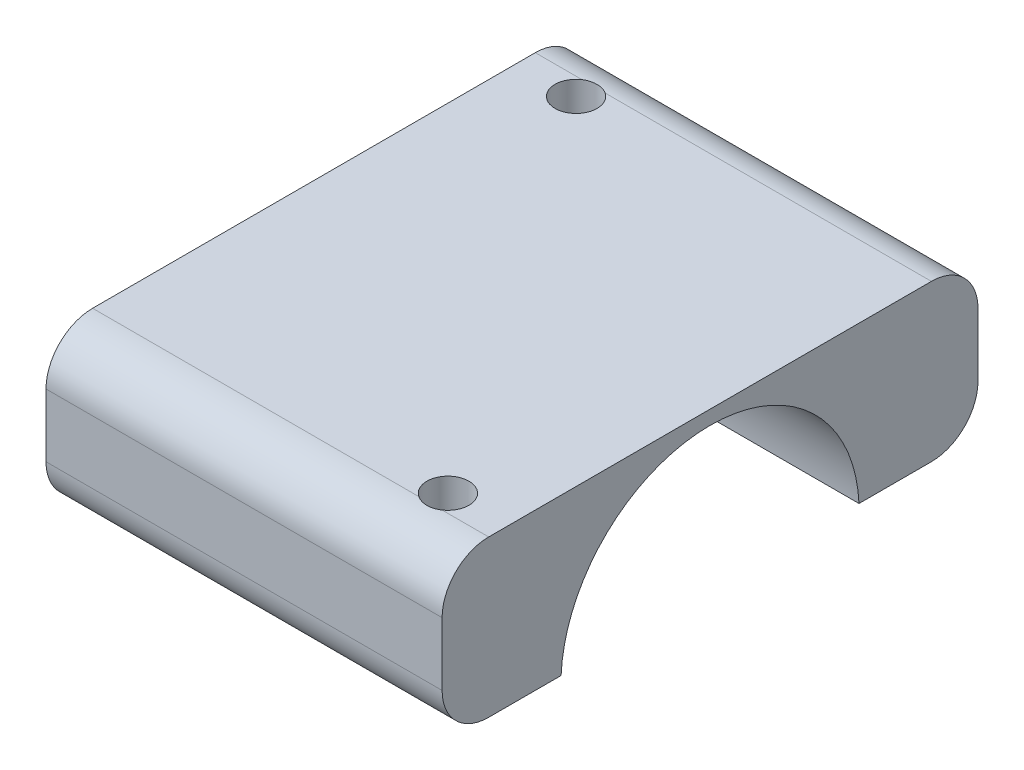
from build123d import *

# Parameters (mm, degrees)
BOSS_EXTRUDE1_DEPTH     = 17
CUT_EXTRUDE1_DEPTH      = 32.84732455
CUT_EXTRUDE1_DEPTH_BACK = 32.84732455
SKETCH2_R               = 12.8
SKETCH3_R               = 1.8
CUT_EXTRUDE2_DEPTH      = 14.009


with BuildPart() as part:
    # Sketch1 → Boss-Extrude1 (new, symmetric)
    with BuildSketch(Plane(origin=(0, 0, 0), x_dir=(0, 0, -1), z_dir=(1, 0, 0))):
        with BuildLine():
            Line((-19, 0.6), (19, 0.6))
            ThreePointArc((19, 0.6), (21.828427125, 1.771572875), (23, 4.6))
            Line((23, 4.6), (23, 10.009))
            ThreePointArc((23, 10.009), (21.828427125, 12.837427125), (19, 14.009))
            Line((19, 14.009), (-19, 14.009))
            ThreePointArc((-19, 14.009), (-21.828427125, 12.837427125), (-23, 10.009))
            Line((-23, 10.009), (-23, 4.6))
            ThreePointArc((-23, 4.6), (-21.828427125, 1.771572875), (-19, 0.6))
        make_face()
    extrude(amount=BOSS_EXTRUDE1_DEPTH, both=True)

    # Sketch2 → Cut-Extrude1 (cut, two sides: drawn at the far end of the back side and taken through both)
    with BuildSketch(Plane(origin=(0, 0, 0), x_dir=(0, 0, -1), z_dir=(1, 0, 0)).offset(-CUT_EXTRUDE1_DEPTH_BACK)):
        Circle(SKETCH2_R)
    extrude(amount=CUT_EXTRUDE1_DEPTH + CUT_EXTRUDE1_DEPTH_BACK, mode=Mode.SUBTRACT)

    # Sketch3 → Cut-Extrude2 (cut)
    with BuildSketch(Plane(origin=(0, 0.6, 0), x_dir=(1, 0, 0), z_dir=(0, 1, 0))):
        with Locations(Location((12, -17.5, 0), (0, 0, 236.442690238))):
            Circle(SKETCH3_R)
        with Locations(Location((-12, 17.5, 0), (0, 0, 123.557309762))):
            Circle(SKETCH3_R)
    extrude(amount=CUT_EXTRUDE2_DEPTH, mode=Mode.SUBTRACT)


solid = part.part
